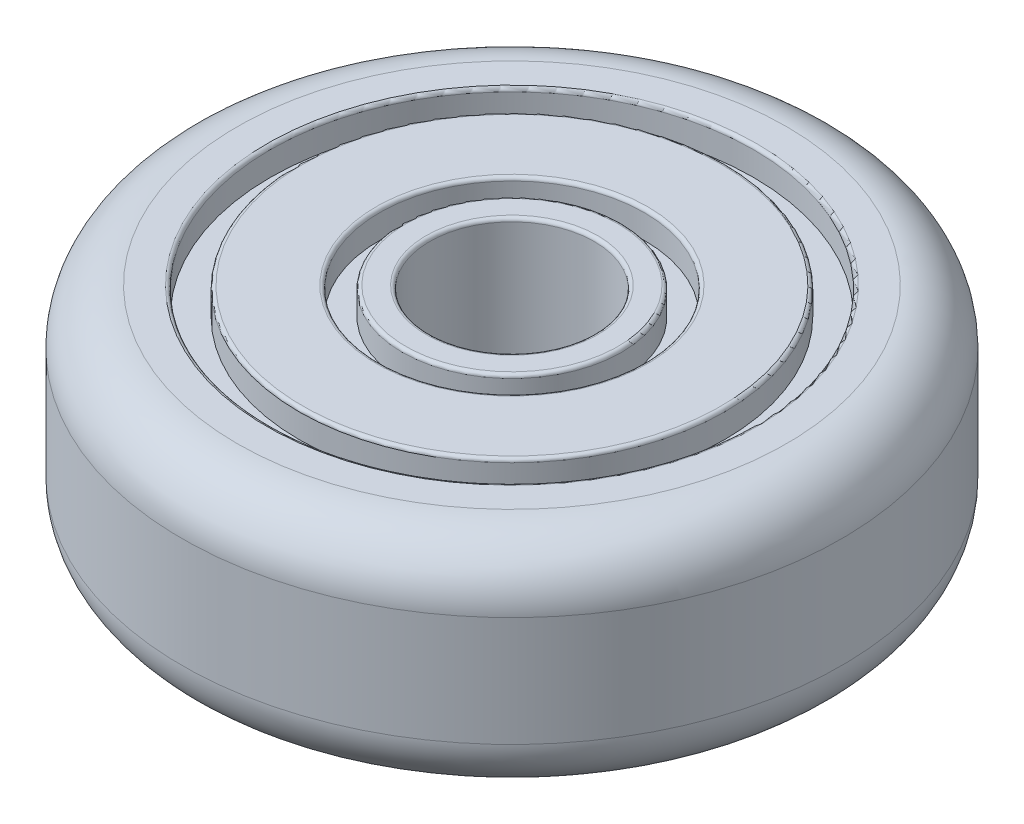
from build123d import *

# Parameters (mm, degrees)
SKETCH1_R           = 12
SKETCH1_R_2         = 3
BOSS_EXTRUDE1_DEPTH = 8
FILLET1_R           = 2
SKETCH3_R           = 8.795689967
SKETCH3_R_2         = 7.745486604
SKETCH3_R_3         = 4.822057037
SKETCH3_R_4         = 3.990813244
CUT_EXTRUDE1_DEPTH  = 1
FILLET2_R           = 0.125


with BuildPart() as part:
    # Sketch1 → Boss-Extrude1 (new body)
    with BuildSketch(Plane(origin=(0, 0, 0), x_dir=(1, 0, 0), z_dir=(0, 1, 0))):
        with Locations(Location((0, 0, 0), (0, 0, 270))):
            Circle(SKETCH1_R)
        with Locations(Location((0, 0, 0), (0, 0, 270))):
            Circle(SKETCH1_R_2, mode=Mode.SUBTRACT)
    extrude(amount=BOSS_EXTRUDE1_DEPTH)

    # Fillet1
    fillet1_edges = [part.edges().sort_by_distance(p)[0] for p in [
        (0, 0, -12),
        (0, 8, -12),
    ]]
    fillet(fillet1_edges, radius=FILLET1_R)

    # Sketch3 → Cut-Extrude1 (cut)
    # profile 1 of 2: a face of its own
    with BuildSketch(Plane(origin=(0, 8, 0), x_dir=(1, 0, 0), z_dir=(0, 1, 0))):
        with Locations(Location((0, 0, 0), (0, 0, 270))):
            Circle(SKETCH3_R)
        with Locations(Location((0, 0, 0), (0, 0, 270))):
            Circle(SKETCH3_R_2, mode=Mode.SUBTRACT)
    # profile 2 of 2: a face of its own
    with BuildSketch(Plane(origin=(0, 8, 0), x_dir=(1, 0, 0), z_dir=(0, 1, 0))):
        with Locations(Location((0, 0, 0), (0, 0, 270))):
            Circle(SKETCH3_R_3)
        with Locations(Location((0, 0, 0), (0, 0, 270))):
            Circle(SKETCH3_R_4, mode=Mode.SUBTRACT)
    cut_extrude1 = extrude(amount=-CUT_EXTRUDE1_DEPTH, mode=Mode.SUBTRACT)

    # Mirror1: Cut-Extrude1 across plane
    add(cut_extrude1.mirror(Plane.ZX.offset(4)), mode=Mode.SUBTRACT)

    # Fillet2
    fillet2_edges = [part.edges().sort_by_distance(p)[0] for p in [
        (0, 8, -3.990813244),
        (0, 8, -4.822057037),
        (0, 8, -7.745486604),
        (0, 8, -8.795689967),
        (0, 8, -3),
    ]]
    fillet(fillet2_edges, radius=FILLET2_R)


solid = part.part
